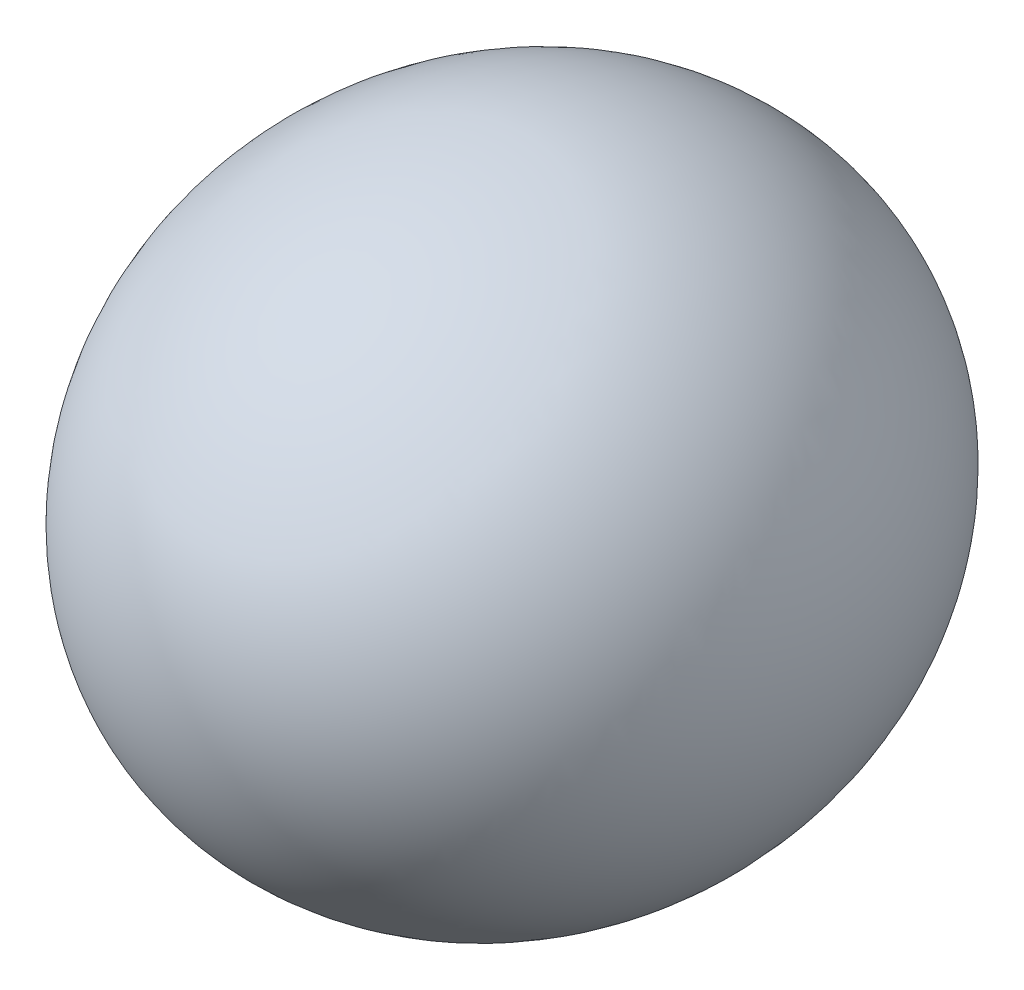
from build123d import *


with BuildPart() as part:
    # Sketch1 → Revolve1 (revolve)
    with BuildSketch(Plane(origin=(0, 0, 0), x_dir=(1, 0, 0), z_dir=(0, 1, 0))):
        with BuildLine():
            Line((0, 68.684762994), (0, -68.684762994))
            add(Edge.make_bspline(
                [(0, -68.684762994), (61.435716449, -68.684762994), (61.435716449, 0), (61.435716449, 68.684762994), (0, 68.684762994)],
                knots=[0, 0, 0, 1.570796327, 1.570796327, 3.141592654, 3.141592654, 3.141592654], degree=2, weights=[1, 0.707106781, 1, 0.707106781, 1]))
        make_face()
    revolve(axis=Axis((0, 0, 1229.134985477), (0, 0, -1)))


solid = part.part
